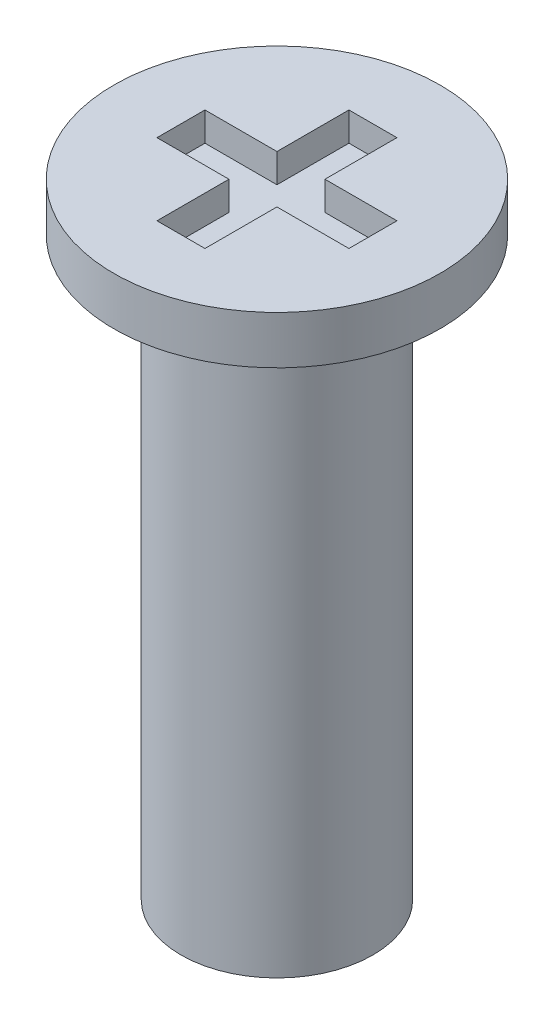
from build123d import *

# Parameters (mm, degrees)
SKETCH_2_W               = 0.5
SKETCH_2_H               = 1
CUT_EXTRUDE_1_DEPTH      = 0.3
PATTERN_CIRCULAR_1_COUNT = 4


with BuildPart() as part:
    # ｽｹｯﾁ1 → 回転1 (revolve)
    with BuildSketch(Plane.XY, mode=Mode.PRIVATE) as revolve_1_sk:
        Polygon((0, 0), (1.7, 0), (1.7, -0.5), (1, -0.5), (1, -6.5), (0, -6.5), align=None)
    revolve(revolve_1_sk.sketch.rotate(Axis((0, -6.5, 0), (0, 1, 0)), 90), axis=Axis((0, -6.5, 0), (0, 1, 0)))

    # ｽｹｯﾁ2 → ｶｯﾄ - 押し出し1 (cut)
    with BuildSketch(Plane(origin=(0, 0, 0), x_dir=(1, 0, 0), z_dir=(0, 1, 0))):
        with Locations((0, 0.5)):
            Rectangle(SKETCH_2_W, SKETCH_2_H)
    cut_extrude_1 = extrude(amount=-CUT_EXTRUDE_1_DEPTH, mode=Mode.SUBTRACT)

    # 円形ﾊﾟﾀｰﾝ1: ｶｯﾄ - 押し出し1 ×4 about axis
    pattern_circular_1_axis = Axis((0, 0, 0), (0, 1, 0))
    for i in range(1, PATTERN_CIRCULAR_1_COUNT):
        add(cut_extrude_1.rotate(pattern_circular_1_axis, i * 360 / PATTERN_CIRCULAR_1_COUNT), mode=Mode.SUBTRACT)


solid = part.part
